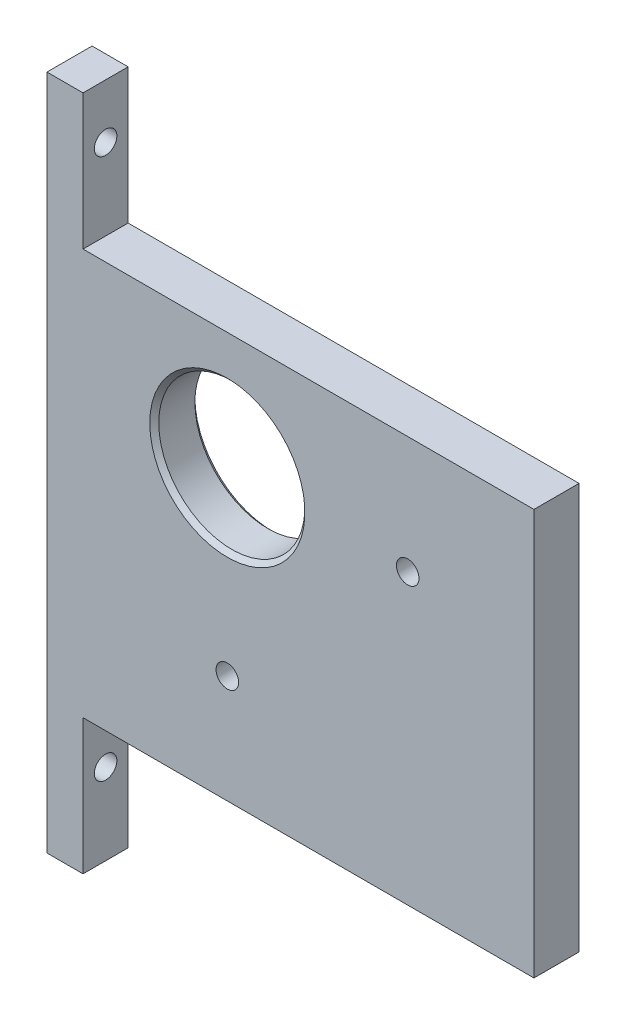
from build123d import *

# Parameters (mm, degrees)
SKETCH_1_R          = 8.1
EXTRUDE_1_DEPTH     = 5
SKETCH_2_R          = 1.25
CUT_EXTRUDE_1_DEPTH = 5
SKETCH_3_R          = 1.25
CUT_EXTRUDE_2_DEPTH = 120
CHAMFER_1_SIZE      = 0.5
SKETCH_4_W          = 16
SKETCH_4_H          = 45
CUT_EXTRUDE_3_DEPTH = 10


with BuildPart() as part:
    # 草图1 → 凸台-拉伸1 (new body)
    with BuildSketch(Plane.XY):
        Polygon((4, 60), (4, 75), (0, 75), (0, 0), (4, 0), (4, 15), (70, 15), (70, 60), align=None)
        with Locations((20, 47)):
            Circle(SKETCH_1_R, mode=Mode.SUBTRACT)
    extrude(amount=EXTRUDE_1_DEPTH)

    # 草图2 → 切除-拉伸1 (cut)
    with BuildSketch(Plane(origin=(4, 0, 0), x_dir=(0, 0, -1), z_dir=(1, 0, 0))):
        with Locations((-2.5, 69)):
            Circle(SKETCH_2_R)
        with Locations((-2.5, 9)):
            Circle(SKETCH_2_R)
    extrude(amount=-CUT_EXTRUDE_1_DEPTH, mode=Mode.SUBTRACT)

    # 草图3 → 切除-拉伸2 (cut)
    with BuildSketch(Plane(origin=(0, 0, 0), x_dir=(-1, 0, 0), z_dir=(0, 0, -1))):
        with Locations((-40, 47)):
            Circle(SKETCH_3_R)
        with Locations((-20, 27)):
            Circle(SKETCH_3_R)
    extrude(amount=-CUT_EXTRUDE_2_DEPTH, mode=Mode.SUBTRACT)

    # 倒角1
    chamfer_1_edges = [part.edges().sort_by_distance(p)[0] for p in [
        (11.9, 47, 0),
        (11.9, 47, 5),
    ]]
    chamfer(chamfer_1_edges, length=CHAMFER_1_SIZE)

    # 草图4 → 切除-拉伸3 (cut)
    with BuildSketch(Plane(origin=(0, 0, 0), x_dir=(-1, 0, 0), z_dir=(0, 0, -1))):
        with Locations((-62, 37.5)):
            Rectangle(SKETCH_4_W, SKETCH_4_H)
    extrude(amount=-CUT_EXTRUDE_3_DEPTH, mode=Mode.SUBTRACT)


solid = part.part
